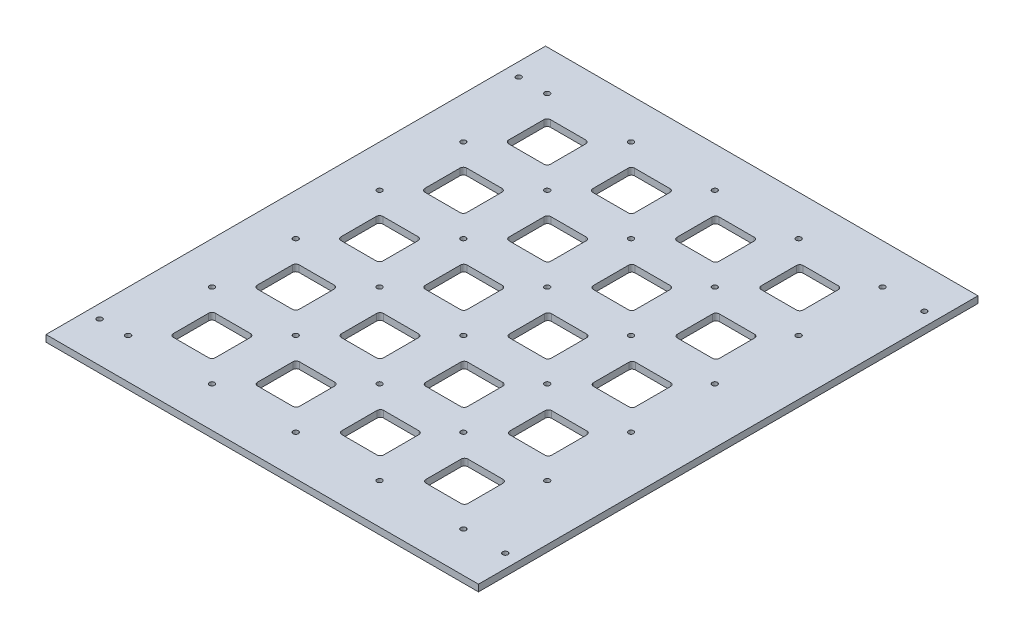
from build123d import *

# Parameters (mm, degrees)
SKETCH1_W           = 258
SKETCH1_H           = 298
SKETCH1_R           = 1.55
BOSS_EXTRUDE1_DEPTH = 4


with BuildPart() as part:
    # Sketch1 → Boss-Extrude1 (new body)
    with BuildSketch(Plane(origin=(0, 0, 0), x_dir=(1, 0, 0), z_dir=(0, 1, 0))):
        with Locations((-129, 149)):
            Rectangle(SKETCH1_W, SKETCH1_H)
        with Locations(Location((-250, 274, 0), (0, 0, 270))):
            Circle(SKETCH1_R, mode=Mode.SUBTRACT)
        with Locations(Location((-8, 274, 0), (0, 0, 90))):
            Circle(SKETCH1_R, mode=Mode.SUBTRACT)
        with Locations(Location((-8, 24, 0), (0, 0, 270))):
            Circle(SKETCH1_R, mode=Mode.SUBTRACT)
        with Locations(Location((-250, 24, 0), (0, 0, 90))):
            Circle(SKETCH1_R, mode=Mode.SUBTRACT)
        with Locations(Location((-233, 274, 0), (0, 0, 270))):
            Circle(SKETCH1_R, mode=Mode.SUBTRACT)
        with Locations(Location((-233, 224, 0), (0, 0, 270))):
            Circle(SKETCH1_R, mode=Mode.SUBTRACT)
        with Locations(Location((-233, 174, 0), (0, 0, 270))):
            Circle(SKETCH1_R, mode=Mode.SUBTRACT)
        with Locations(Location((-233, 124, 0), (0, 0, 270))):
            Circle(SKETCH1_R, mode=Mode.SUBTRACT)
        with Locations(Location((-233, 74, 0), (0, 0, 270))):
            Circle(SKETCH1_R, mode=Mode.SUBTRACT)
        with Locations(Location((-233, 24, 0), (0, 0, 270))):
            Circle(SKETCH1_R, mode=Mode.SUBTRACT)
        with Locations(Location((-183, 24, 0), (0, 0, 270))):
            Circle(SKETCH1_R, mode=Mode.SUBTRACT)
        with Locations(Location((-183, 74, 0), (0, 0, 270))):
            Circle(SKETCH1_R, mode=Mode.SUBTRACT)
        with Locations(Location((-183, 124, 0), (0, 0, 270))):
            Circle(SKETCH1_R, mode=Mode.SUBTRACT)
        with Locations(Location((-183, 174, 0), (0, 0, 270))):
            Circle(SKETCH1_R, mode=Mode.SUBTRACT)
        with Locations(Location((-183, 224, 0), (0, 0, 270))):
            Circle(SKETCH1_R, mode=Mode.SUBTRACT)
        with Locations(Location((-183, 274, 0), (0, 0, 270))):
            Circle(SKETCH1_R, mode=Mode.SUBTRACT)
        with Locations(Location((-133, 24, 0), (0, 0, 270))):
            Circle(SKETCH1_R, mode=Mode.SUBTRACT)
        with Locations(Location((-133, 74, 0), (0, 0, 270))):
            Circle(SKETCH1_R, mode=Mode.SUBTRACT)
        with Locations(Location((-133, 124, 0), (0, 0, 270))):
            Circle(SKETCH1_R, mode=Mode.SUBTRACT)
        with Locations(Location((-133, 174, 0), (0, 0, 270))):
            Circle(SKETCH1_R, mode=Mode.SUBTRACT)
        with Locations(Location((-133, 224, 0), (0, 0, 270))):
            Circle(SKETCH1_R, mode=Mode.SUBTRACT)
        with Locations(Location((-133, 274, 0), (0, 0, 270))):
            Circle(SKETCH1_R, mode=Mode.SUBTRACT)
        with Locations(Location((-83, 24, 0), (0, 0, 270))):
            Circle(SKETCH1_R, mode=Mode.SUBTRACT)
        with Locations(Location((-83, 74, 0), (0, 0, 270))):
            Circle(SKETCH1_R, mode=Mode.SUBTRACT)
        with Locations(Location((-83, 124, 0), (0, 0, 270))):
            Circle(SKETCH1_R, mode=Mode.SUBTRACT)
        with Locations(Location((-83, 174, 0), (0, 0, 270))):
            Circle(SKETCH1_R, mode=Mode.SUBTRACT)
        with Locations(Location((-83, 224, 0), (0, 0, 270))):
            Circle(SKETCH1_R, mode=Mode.SUBTRACT)
        with Locations(Location((-83, 274, 0), (0, 0, 270))):
            Circle(SKETCH1_R, mode=Mode.SUBTRACT)
        with Locations(Location((-33, 24, 0), (0, 0, 270))):
            Circle(SKETCH1_R, mode=Mode.SUBTRACT)
        with Locations(Location((-33, 74, 0), (0, 0, 270))):
            Circle(SKETCH1_R, mode=Mode.SUBTRACT)
        with Locations(Location((-33, 124, 0), (0, 0, 270))):
            Circle(SKETCH1_R, mode=Mode.SUBTRACT)
        with Locations(Location((-33, 174, 0), (0, 0, 270))):
            Circle(SKETCH1_R, mode=Mode.SUBTRACT)
        with Locations(Location((-33, 224, 0), (0, 0, 270))):
            Circle(SKETCH1_R, mode=Mode.SUBTRACT)
        with Locations(Location((-33, 274, 0), (0, 0, 270))):
            Circle(SKETCH1_R, mode=Mode.SUBTRACT)
        with BuildLine():
            Line((-218.5, 261.5), (-197.5, 261.5))
            ThreePointArc((-197.5, 261.5), (-196.085786438, 260.914213562), (-195.5, 259.5))
            Line((-195.5, 259.5), (-195.5, 238.5))
            ThreePointArc((-195.5, 238.5), (-196.085786438, 237.085786438), (-197.5, 236.5))
            Line((-197.5, 236.5), (-218.5, 236.5))
            ThreePointArc((-218.5, 236.5), (-219.914213562, 237.085786438), (-220.5, 238.5))
            Line((-220.5, 238.5), (-220.5, 259.5))
            ThreePointArc((-220.5, 259.5), (-219.914213562, 260.914213562), (-218.5, 261.5))
        make_face(mode=Mode.SUBTRACT)
        with BuildLine():
            Line((-170.273804043, 259.5), (-170.273804043, 238.5))
            ThreePointArc((-170.273804043, 238.5), (-169.688017605, 237.085786438), (-168.273804043, 236.5))
            Line((-168.273804043, 236.5), (-147.273804043, 236.5))
            ThreePointArc((-147.273804043, 236.5), (-145.85959048, 237.085786438), (-145.273804043, 238.5))
            Line((-145.273804043, 238.5), (-145.273804043, 259.5))
            ThreePointArc((-145.273804043, 259.5), (-145.85959048, 260.914213562), (-147.273804043, 261.5))
            Line((-147.273804043, 261.5), (-168.273804043, 261.5))
            ThreePointArc((-168.273804043, 261.5), (-169.688017605, 260.914213562), (-170.273804043, 259.5))
        make_face(mode=Mode.SUBTRACT)
        with BuildLine():
            Line((-120.047608086, 259.5), (-120.047608086, 238.5))
            ThreePointArc((-120.047608086, 238.5), (-119.461821648, 237.085786438), (-118.047608086, 236.5))
            Line((-118.047608086, 236.5), (-97.047608086, 236.5))
            ThreePointArc((-97.047608086, 236.5), (-95.633394523, 237.085786438), (-95.047608086, 238.5))
            Line((-95.047608086, 238.5), (-95.047608086, 259.5))
            ThreePointArc((-95.047608086, 259.5), (-95.633394523, 260.914213562), (-97.047608086, 261.5))
            Line((-97.047608086, 261.5), (-118.047608086, 261.5))
            ThreePointArc((-118.047608086, 261.5), (-119.461821648, 260.914213562), (-120.047608086, 259.5))
        make_face(mode=Mode.SUBTRACT)
        with BuildLine():
            Line((-69.821412128, 259.5), (-69.821412128, 238.5))
            ThreePointArc((-69.821412128, 238.5), (-69.235625691, 237.085786438), (-67.821412128, 236.5))
            Line((-67.821412128, 236.5), (-46.821412128, 236.5))
            ThreePointArc((-46.821412128, 236.5), (-45.407198566, 237.085786438), (-44.821412128, 238.5))
            Line((-44.821412128, 238.5), (-44.821412128, 259.5))
            ThreePointArc((-44.821412128, 259.5), (-45.407198566, 260.914213562), (-46.821412128, 261.5))
            Line((-46.821412128, 261.5), (-67.821412128, 261.5))
            ThreePointArc((-67.821412128, 261.5), (-69.235625691, 260.914213562), (-69.821412128, 259.5))
        make_face(mode=Mode.SUBTRACT)
        with BuildLine():
            Line((-220.5, 209.5), (-220.5, 188.5))
            ThreePointArc((-220.5, 188.5), (-219.914213562, 187.085786438), (-218.5, 186.5))
            Line((-218.5, 186.5), (-197.5, 186.5))
            ThreePointArc((-197.5, 186.5), (-196.085786438, 187.085786438), (-195.5, 188.5))
            Line((-195.5, 188.5), (-195.5, 209.5))
            ThreePointArc((-195.5, 209.5), (-196.085786438, 210.914213562), (-197.5, 211.5))
            Line((-197.5, 211.5), (-218.5, 211.5))
            ThreePointArc((-218.5, 211.5), (-219.914213562, 210.914213562), (-220.5, 209.5))
        make_face(mode=Mode.SUBTRACT)
        with BuildLine():
            Line((-170.273804043, 209.5), (-170.273804043, 188.5))
            ThreePointArc((-170.273804043, 188.5), (-169.688017605, 187.085786438), (-168.273804043, 186.5))
            Line((-168.273804043, 186.5), (-147.273804043, 186.5))
            ThreePointArc((-147.273804043, 186.5), (-145.85959048, 187.085786438), (-145.273804043, 188.5))
            Line((-145.273804043, 188.5), (-145.273804043, 209.5))
            ThreePointArc((-145.273804043, 209.5), (-145.85959048, 210.914213562), (-147.273804043, 211.5))
            Line((-147.273804043, 211.5), (-168.273804043, 211.5))
            ThreePointArc((-168.273804043, 211.5), (-169.688017605, 210.914213562), (-170.273804043, 209.5))
        make_face(mode=Mode.SUBTRACT)
        with BuildLine():
            Line((-120.047608086, 209.5), (-120.047608086, 188.5))
            ThreePointArc((-120.047608086, 188.5), (-119.461821648, 187.085786438), (-118.047608086, 186.5))
            Line((-118.047608086, 186.5), (-97.047608086, 186.5))
            ThreePointArc((-97.047608086, 186.5), (-95.633394523, 187.085786438), (-95.047608086, 188.5))
            Line((-95.047608086, 188.5), (-95.047608086, 209.5))
            ThreePointArc((-95.047608086, 209.5), (-95.633394523, 210.914213562), (-97.047608086, 211.5))
            Line((-97.047608086, 211.5), (-118.047608086, 211.5))
            ThreePointArc((-118.047608086, 211.5), (-119.461821648, 210.914213562), (-120.047608086, 209.5))
        make_face(mode=Mode.SUBTRACT)
        with BuildLine():
            Line((-69.821412128, 209.5), (-69.821412128, 188.5))
            ThreePointArc((-69.821412128, 188.5), (-69.235625691, 187.085786438), (-67.821412128, 186.5))
            Line((-67.821412128, 186.5), (-46.821412128, 186.5))
            ThreePointArc((-46.821412128, 186.5), (-45.407198566, 187.085786438), (-44.821412128, 188.5))
            Line((-44.821412128, 188.5), (-44.821412128, 209.5))
            ThreePointArc((-44.821412128, 209.5), (-45.407198566, 210.914213562), (-46.821412128, 211.5))
            Line((-46.821412128, 211.5), (-67.821412128, 211.5))
            ThreePointArc((-67.821412128, 211.5), (-69.235625691, 210.914213562), (-69.821412128, 209.5))
        make_face(mode=Mode.SUBTRACT)
        with BuildLine():
            Line((-220.5, 159.5), (-220.5, 138.5))
            ThreePointArc((-220.5, 138.5), (-219.914213562, 137.085786438), (-218.5, 136.5))
            Line((-218.5, 136.5), (-197.5, 136.5))
            ThreePointArc((-197.5, 136.5), (-196.085786438, 137.085786438), (-195.5, 138.5))
            Line((-195.5, 138.5), (-195.5, 159.5))
            ThreePointArc((-195.5, 159.5), (-196.085786438, 160.914213562), (-197.5, 161.5))
            Line((-197.5, 161.5), (-218.5, 161.5))
            ThreePointArc((-218.5, 161.5), (-219.914213562, 160.914213562), (-220.5, 159.5))
        make_face(mode=Mode.SUBTRACT)
        with BuildLine():
            Line((-170.273804043, 159.5), (-170.273804043, 138.5))
            ThreePointArc((-170.273804043, 138.5), (-169.688017605, 137.085786438), (-168.273804043, 136.5))
            Line((-168.273804043, 136.5), (-147.273804043, 136.5))
            ThreePointArc((-147.273804043, 136.5), (-145.85959048, 137.085786438), (-145.273804043, 138.5))
            Line((-145.273804043, 138.5), (-145.273804043, 159.5))
            ThreePointArc((-145.273804043, 159.5), (-145.85959048, 160.914213562), (-147.273804043, 161.5))
            Line((-147.273804043, 161.5), (-168.273804043, 161.5))
            ThreePointArc((-168.273804043, 161.5), (-169.688017605, 160.914213562), (-170.273804043, 159.5))
        make_face(mode=Mode.SUBTRACT)
        with BuildLine():
            Line((-120.047608086, 159.5), (-120.047608086, 138.5))
            ThreePointArc((-120.047608086, 138.5), (-119.461821648, 137.085786438), (-118.047608086, 136.5))
            Line((-118.047608086, 136.5), (-97.047608086, 136.5))
            ThreePointArc((-97.047608086, 136.5), (-95.633394523, 137.085786438), (-95.047608086, 138.5))
            Line((-95.047608086, 138.5), (-95.047608086, 159.5))
            ThreePointArc((-95.047608086, 159.5), (-95.633394523, 160.914213562), (-97.047608086, 161.5))
            Line((-97.047608086, 161.5), (-118.047608086, 161.5))
            ThreePointArc((-118.047608086, 161.5), (-119.461821648, 160.914213562), (-120.047608086, 159.5))
        make_face(mode=Mode.SUBTRACT)
        with BuildLine():
            Line((-69.821412128, 159.5), (-69.821412128, 138.5))
            ThreePointArc((-69.821412128, 138.5), (-69.235625691, 137.085786438), (-67.821412128, 136.5))
            Line((-67.821412128, 136.5), (-46.821412128, 136.5))
            ThreePointArc((-46.821412128, 136.5), (-45.407198566, 137.085786438), (-44.821412128, 138.5))
            Line((-44.821412128, 138.5), (-44.821412128, 159.5))
            ThreePointArc((-44.821412128, 159.5), (-45.407198566, 160.914213562), (-46.821412128, 161.5))
            Line((-46.821412128, 161.5), (-67.821412128, 161.5))
            ThreePointArc((-67.821412128, 161.5), (-69.235625691, 160.914213562), (-69.821412128, 159.5))
        make_face(mode=Mode.SUBTRACT)
        with BuildLine():
            Line((-220.5, 109.5), (-220.5, 88.5))
            ThreePointArc((-220.5, 88.5), (-219.914213562, 87.085786438), (-218.5, 86.5))
            Line((-218.5, 86.5), (-197.5, 86.5))
            ThreePointArc((-197.5, 86.5), (-196.085786438, 87.085786438), (-195.5, 88.5))
            Line((-195.5, 88.5), (-195.5, 109.5))
            ThreePointArc((-195.5, 109.5), (-196.085786438, 110.914213562), (-197.5, 111.5))
            Line((-197.5, 111.5), (-218.5, 111.5))
            ThreePointArc((-218.5, 111.5), (-219.914213562, 110.914213562), (-220.5, 109.5))
        make_face(mode=Mode.SUBTRACT)
        with BuildLine():
            Line((-170.273804043, 109.5), (-170.273804043, 88.5))
            ThreePointArc((-170.273804043, 88.5), (-169.688017605, 87.085786438), (-168.273804043, 86.5))
            Line((-168.273804043, 86.5), (-147.273804043, 86.5))
            ThreePointArc((-147.273804043, 86.5), (-145.85959048, 87.085786438), (-145.273804043, 88.5))
            Line((-145.273804043, 88.5), (-145.273804043, 109.5))
            ThreePointArc((-145.273804043, 109.5), (-145.85959048, 110.914213562), (-147.273804043, 111.5))
            Line((-147.273804043, 111.5), (-168.273804043, 111.5))
            ThreePointArc((-168.273804043, 111.5), (-169.688017605, 110.914213562), (-170.273804043, 109.5))
        make_face(mode=Mode.SUBTRACT)
        with BuildLine():
            Line((-120.047608086, 109.5), (-120.047608086, 88.5))
            ThreePointArc((-120.047608086, 88.5), (-119.461821648, 87.085786438), (-118.047608086, 86.5))
            Line((-118.047608086, 86.5), (-97.047608086, 86.5))
            ThreePointArc((-97.047608086, 86.5), (-95.633394523, 87.085786438), (-95.047608086, 88.5))
            Line((-95.047608086, 88.5), (-95.047608086, 109.5))
            ThreePointArc((-95.047608086, 109.5), (-95.633394523, 110.914213562), (-97.047608086, 111.5))
            Line((-97.047608086, 111.5), (-118.047608086, 111.5))
            ThreePointArc((-118.047608086, 111.5), (-119.461821648, 110.914213562), (-120.047608086, 109.5))
        make_face(mode=Mode.SUBTRACT)
        with BuildLine():
            Line((-69.821412128, 109.5), (-69.821412128, 88.5))
            ThreePointArc((-69.821412128, 88.5), (-69.235625691, 87.085786438), (-67.821412128, 86.5))
            Line((-67.821412128, 86.5), (-46.821412128, 86.5))
            ThreePointArc((-46.821412128, 86.5), (-45.407198566, 87.085786438), (-44.821412128, 88.5))
            Line((-44.821412128, 88.5), (-44.821412128, 109.5))
            ThreePointArc((-44.821412128, 109.5), (-45.407198566, 110.914213562), (-46.821412128, 111.5))
            Line((-46.821412128, 111.5), (-67.821412128, 111.5))
            ThreePointArc((-67.821412128, 111.5), (-69.235625691, 110.914213562), (-69.821412128, 109.5))
        make_face(mode=Mode.SUBTRACT)
        with BuildLine():
            Line((-220.5, 59.5), (-220.5, 38.5))
            ThreePointArc((-220.5, 38.5), (-219.914213562, 37.085786438), (-218.5, 36.5))
            Line((-218.5, 36.5), (-197.5, 36.5))
            ThreePointArc((-197.5, 36.5), (-196.085786438, 37.085786438), (-195.5, 38.5))
            Line((-195.5, 38.5), (-195.5, 59.5))
            ThreePointArc((-195.5, 59.5), (-196.085786438, 60.914213562), (-197.5, 61.5))
            Line((-197.5, 61.5), (-218.5, 61.5))
            ThreePointArc((-218.5, 61.5), (-219.914213562, 60.914213562), (-220.5, 59.5))
        make_face(mode=Mode.SUBTRACT)
        with BuildLine():
            Line((-170.273804043, 59.5), (-170.273804043, 38.5))
            ThreePointArc((-170.273804043, 38.5), (-169.688017605, 37.085786438), (-168.273804043, 36.5))
            Line((-168.273804043, 36.5), (-147.273804043, 36.5))
            ThreePointArc((-147.273804043, 36.5), (-145.85959048, 37.085786438), (-145.273804043, 38.5))
            Line((-145.273804043, 38.5), (-145.273804043, 59.5))
            ThreePointArc((-145.273804043, 59.5), (-145.85959048, 60.914213562), (-147.273804043, 61.5))
            Line((-147.273804043, 61.5), (-168.273804043, 61.5))
            ThreePointArc((-168.273804043, 61.5), (-169.688017605, 60.914213562), (-170.273804043, 59.5))
        make_face(mode=Mode.SUBTRACT)
        with BuildLine():
            Line((-120.047608086, 59.5), (-120.047608086, 38.5))
            ThreePointArc((-120.047608086, 38.5), (-119.461821648, 37.085786438), (-118.047608086, 36.5))
            Line((-118.047608086, 36.5), (-97.047608086, 36.5))
            ThreePointArc((-97.047608086, 36.5), (-95.633394523, 37.085786438), (-95.047608086, 38.5))
            Line((-95.047608086, 38.5), (-95.047608086, 59.5))
            ThreePointArc((-95.047608086, 59.5), (-95.633394523, 60.914213562), (-97.047608086, 61.5))
            Line((-97.047608086, 61.5), (-118.047608086, 61.5))
            ThreePointArc((-118.047608086, 61.5), (-119.461821648, 60.914213562), (-120.047608086, 59.5))
        make_face(mode=Mode.SUBTRACT)
        with BuildLine():
            Line((-69.821412128, 59.5), (-69.821412128, 38.5))
            ThreePointArc((-69.821412128, 38.5), (-69.235625691, 37.085786438), (-67.821412128, 36.5))
            Line((-67.821412128, 36.5), (-46.821412128, 36.5))
            ThreePointArc((-46.821412128, 36.5), (-45.407198566, 37.085786438), (-44.821412128, 38.5))
            Line((-44.821412128, 38.5), (-44.821412128, 59.5))
            ThreePointArc((-44.821412128, 59.5), (-45.407198566, 60.914213562), (-46.821412128, 61.5))
            Line((-46.821412128, 61.5), (-67.821412128, 61.5))
            ThreePointArc((-67.821412128, 61.5), (-69.235625691, 60.914213562), (-69.821412128, 59.5))
        make_face(mode=Mode.SUBTRACT)
    extrude(amount=BOSS_EXTRUDE1_DEPTH)


solid = part.part
